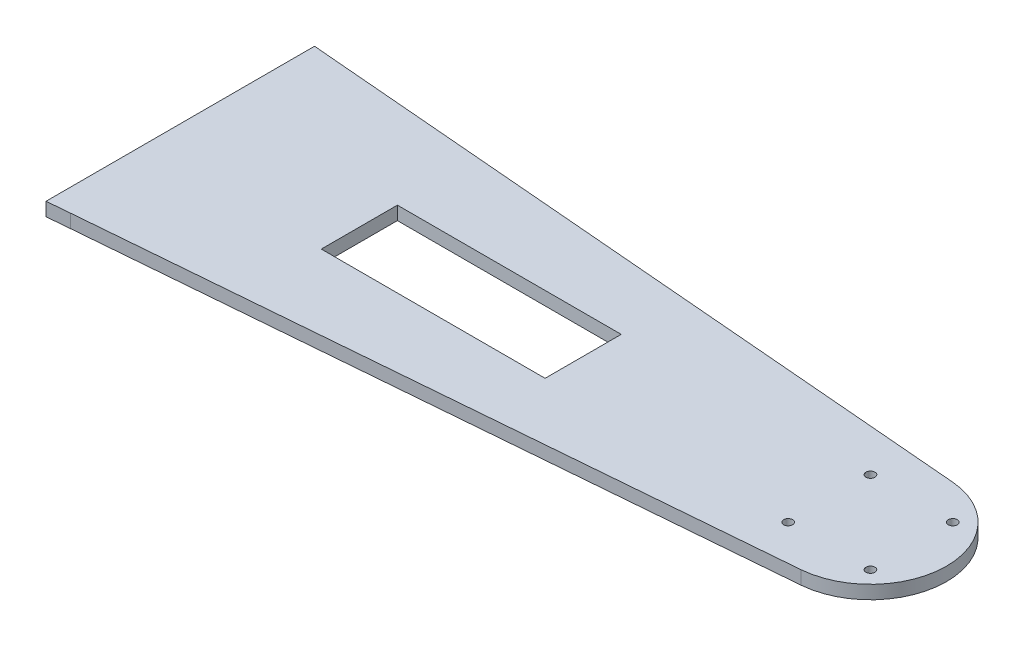
from build123d import *

# Parameters (mm, degrees)
SKETCH1_R           = 1
BOSS_EXTRUDE1_DEPTH = 3
SKETCH2_W           = 50
SKETCH2_H           = 17
CUT_EXTRUDE1_DEPTH  = 177.568989461


with BuildPart() as part:
    # Sketch1 → Boss-Extrude1 (new body)
    with BuildSketch(Plane(origin=(0, 0, 0), x_dir=(1, 0, 0), z_dir=(0, 1, 0))):
        with BuildLine():
            Line((0, 0), (150.612084668, 12.621940938))
            ThreePointArc((150.612084668, 12.621940938), (166.192388155, 29.562556682), (150.612084668, 46.503172427))
            Line((150.612084668, 46.503172427), (0, 59.125113365))
            Line((0, 59.125113365), (-5, 59.562556682))
            Line((-5, 59.562556682), (-5, -0.437443318))
            Line((-5, -0.437443318), (0, 0))
        make_face()
        with Locations(Location((140, 38.754944838, 0), (0, 0, 270))):
            Circle(SKETCH1_R, mode=Mode.SUBTRACT)
        with Locations(Location((140, 20.370168527, 0), (0, 0, 270))):
            Circle(SKETCH1_R, mode=Mode.SUBTRACT)
        with Locations(Location((158.384776311, 20.370168527, 0), (0, 0, 270))):
            Circle(SKETCH1_R, mode=Mode.SUBTRACT)
        with Locations(Location((158.384776311, 38.754944838, 0), (0, 0, 270))):
            Circle(SKETCH1_R, mode=Mode.SUBTRACT)
    extrude(amount=BOSS_EXTRUDE1_DEPTH)

    # Sketch2 → Cut-Extrude1 (cut, through all)
    with BuildSketch(Plane(origin=(0, 3, 0), x_dir=(1, 0, 0), z_dir=(0, 1, 0))):
        with Locations((60, 29.562556682)):
            Rectangle(SKETCH2_W, SKETCH2_H)
    extrude(amount=-CUT_EXTRUDE1_DEPTH, mode=Mode.SUBTRACT)


solid = part.part
